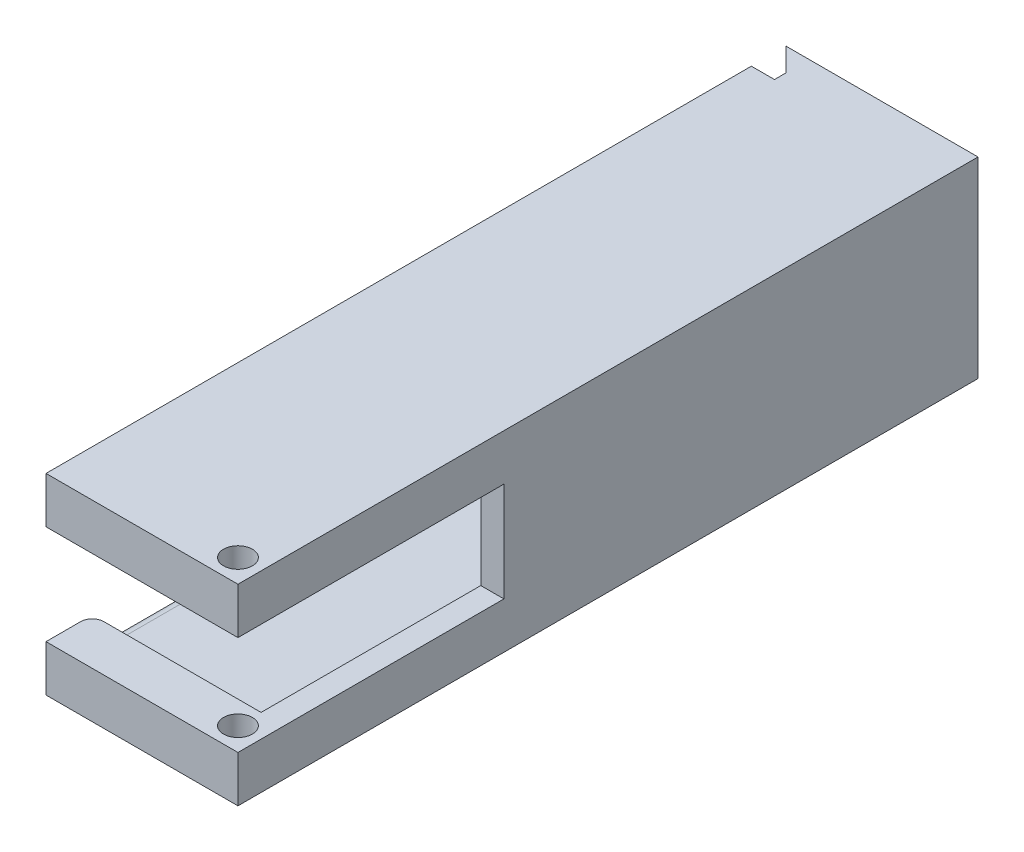
from build123d import *

# Parameters (mm, degrees)
SKETCH1_W               = 16.6
SKETCH1_H               = 62
BOSS_EXTRUDE1_DEPTH     = 2
SKETCH1_7_W             = 2
SKETCH1_7_H             = 41
BOSS_EXTRUDE2_DEPTH     = 12.6
SKETCH2_W               = 16.6
SKETCH2_H               = 62
BOSS_EXTRUDE3_DEPTH     = 2
SKETCH3_W               = 41
SKETCH3_H               = 8.6
CUT_EXTRUDE1_DEPTH      = 2
CUT_EXTRUDE2_DEPTH      = 2
CUT_EXTRUDE4_DEPTH      = 17.5
CUT_EXTRUDE4_DEPTH_BACK = 14.5
SKETCH5_W               = 21
SKETCH5_H               = 8.6
SKETCH7_W               = 16.6
SKETCH7_H               = 4
BOSS_EXTRUDE4_DEPTH     = 2
SKETCH9_R               = 1.25
CUT_EXTRUDE6_DEPTH      = 20
FILLET3_R               = 1
CUT_EXTRUDE7_DEPTH      = 21
SKETCH13_W              = 2
SKETCH13_H              = 2
CUT_EXTRUDE8_DEPTH      = 3


with BuildPart() as part:
    # Sketch1 → Boss-Extrude1 (new body)
    with BuildSketch(Plane(origin=(0, 0, 0), x_dir=(1, 0, 0), z_dir=(0, 1, 0))):
        with Locations((8.3, 29)):
            Rectangle(SKETCH1_W, SKETCH1_H)
    extrude(amount=-BOSS_EXTRUDE1_DEPTH)

    # Sketch1<7> → Boss-Extrude2 (add)
    with BuildSketch(Plane(origin=(0, 0, 0), x_dir=(1, 0, 0), z_dir=(0, 1, 0))):
        with Locations((1, 39.5)):
            Rectangle(SKETCH1_7_W, SKETCH1_7_H)
        Polygon((16.6, 60), (14.6, 60), (14.6, 0), (0, 0), (0, -2), (16.6, -2), align=None)
    extrude(amount=BOSS_EXTRUDE2_DEPTH)

    # Sketch2 → Boss-Extrude3 (add)
    with BuildSketch(Plane(origin=(0, 12.6, 0), x_dir=(1, 0, 0), z_dir=(0, 1, 0))):
        with Locations((8.3, 29)):
            Rectangle(SKETCH2_W, SKETCH2_H)
    extrude(amount=BOSS_EXTRUDE3_DEPTH)

    # Sketch3 → Cut-Extrude1 (cut)
    with BuildSketch(Plane.ZY):
        with Locations((-39.5, 6.3)):
            Rectangle(SKETCH3_W, SKETCH3_H)
    extrude(amount=-CUT_EXTRUDE1_DEPTH, mode=Mode.SUBTRACT)

    # Sketch4 → Cut-Extrude2 (cut)
    with BuildSketch(Plane.ZY):
        with BuildLine():
            ThreePointArc((-20.999, 2), (-19.585493544, 1.414506456), (-19, 0.001))
            Line((-19, 0.001), (-19, 2))
            Line((-19, 2), (-20.999, 2))
        make_face()
        with BuildLine():
            ThreePointArc((-19, 12.599), (-19.585493544, 11.185493544), (-20.999, 10.6))
            Line((-20.999, 10.6), (-19, 10.6))
            Line((-19, 10.6), (-19, 12.599))
        make_face()
    extrude(amount=-CUT_EXTRUDE2_DEPTH, mode=Mode.SUBTRACT)

    # Sketch5 → Cut-Extrude4 (cut, two sides: drawn at the far end of the back side and taken through both)
    with BuildSketch(Plane.ZY.offset(-14.6).offset(-CUT_EXTRUDE4_DEPTH_BACK)):
        with Locations((-8.5, 6.3)):
            Rectangle(SKETCH5_W, SKETCH5_H)
    extrude(amount=CUT_EXTRUDE4_DEPTH + CUT_EXTRUDE4_DEPTH_BACK, mode=Mode.SUBTRACT)

    # Sketch7 → Boss-Extrude4 (add)
    with BuildSketch(Plane.XY.offset(2)):
        with Locations((8.3, 0)):
            Rectangle(SKETCH7_W, SKETCH7_H)
        with Locations((8.3, 12.6)):
            Rectangle(SKETCH7_W, SKETCH7_H)
    extrude(amount=BOSS_EXTRUDE4_DEPTH)

    # Sketch9 → Cut-Extrude6 (cut)
    with BuildSketch(Plane(origin=(0, 14.6, 0), x_dir=(1, 0, 0), z_dir=(0, 1, 0))):
        with Locations((14.6, -2)):
            Circle(SKETCH9_R)
    extrude(amount=-CUT_EXTRUDE6_DEPTH, mode=Mode.SUBTRACT)

    # Fillet3
    fillet3_edges = [part.edges().sort_by_distance(p)[0] for p in [
        (0, 12.6, -9.5),
        (0, 11.6, 0),
        (0, 1, 0),
        (0, 0, -9.5),
    ]]
    fillet(fillet3_edges, radius=FILLET3_R)

    # Sketch12 → Cut-Extrude7 (cut)
    with BuildSketch(Plane(origin=(0, -2, 0), x_dir=(-1, 0, 0), z_dir=(0, -1, 0))):
        Polygon((0, 59.999), (0, 60), (-1.99900025, 58.00000025), (-2, 57.999), (-2, 57), (0, 57), (0, 57.999), (0, 58), align=None)
    extrude(amount=-CUT_EXTRUDE7_DEPTH, mode=Mode.SUBTRACT)

    # Sketch13 → Cut-Extrude8 (cut)
    with BuildSketch(Plane(origin=(0, 0, -60), x_dir=(-1, 0, 0), z_dir=(0, 0, -1))):
        with Locations((-1, 11.6)):
            Rectangle(SKETCH13_W, SKETCH13_H)
        with Locations((-1, 1)):
            Rectangle(SKETCH13_W, SKETCH13_H)
    extrude(amount=-CUT_EXTRUDE8_DEPTH, mode=Mode.SUBTRACT)


solid = part.part
